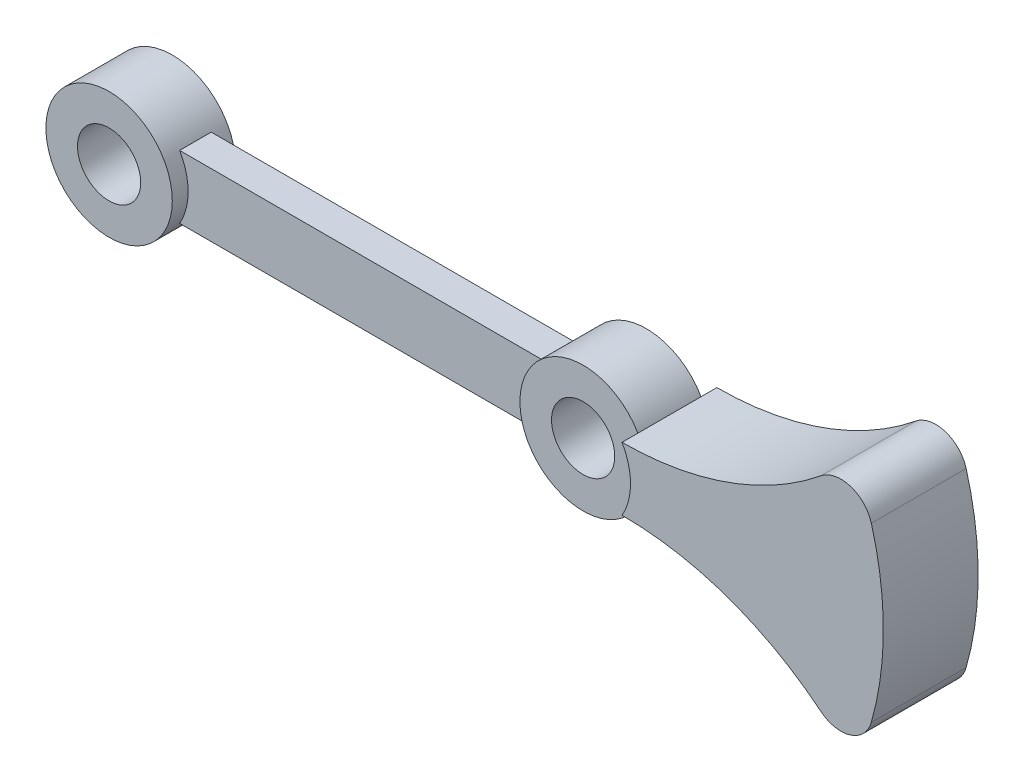
from build123d import *

# Parameters (mm, degrees)
SKETCH1_R             = 12
SKETCH1_R_2           = 6
BOSS_EXTRUDE1_DEPTH   = 6
BOSS_EXTRUDE1_2_DEPTH = 6
BOSS_EXTRUDE2_DEPTH   = 3
BOSS_EXTRUDE3_DEPTH   = 9


with BuildPart() as part:
    # Sketch1 → Boss-Extrude1 (new, symmetric)
    with BuildSketch(Plane.XY):
        with Locations((-45, 0)):
            Circle(SKETCH1_R)
        with Locations((-45, 0)):
            Circle(SKETCH1_R_2, mode=Mode.SUBTRACT)
    extrude(amount=BOSS_EXTRUDE1_DEPTH, both=True)



with BuildPart() as body_2:
    # Sketch1 → Boss-Extrude1 2 (new, symmetric)
    with BuildSketch(Plane.XY):
        with Locations((45, 0)):
            Circle(SKETCH1_R)
        with Locations((45, 0)):
            Circle(SKETCH1_R_2, mode=Mode.SUBTRACT)
    extrude(amount=BOSS_EXTRUDE1_2_DEPTH, both=True)


with BuildPart() as part_1:
    add(part.part)

    add(body_2.part)  # Boss-Extrude2 merges body 2
    # Sketch3 → Boss-Extrude2 (add, symmetric)
    with BuildSketch(Plane.XY):
        with BuildLine():
            Line((-34.607695155, 6), (34.607695155, 6))
            ThreePointArc((34.607695155, 6), (33, 0), (34.607695155, -6))
            Line((34.607695155, -6), (-34.607695155, -6))
            ThreePointArc((-34.607695155, -6), (-33, 0), (-34.607695155, 6))
        make_face()
    extrude(amount=BOSS_EXTRUDE2_DEPTH, both=True)

    # Sketch4 → Boss-Extrude3 (add, symmetric)
    with BuildSketch(Plane.XY):
        with BuildLine():
            ThreePointArc((55.392304845, 6), (75.434547778, 9.446410386), (93.174330904, 19.389716726))
            ThreePointArc((93.174330904, 19.389716726), (98.763947455, 20.448721573), (102.725037233, 16.365209331))
            ThreePointArc((102.725037233, 16.365209331), (105, 0), (102.725037233, -16.365209331))
            ThreePointArc((102.725037233, -16.365209331), (98.763947455, -20.448721573), (93.174330904, -19.389716726))
            ThreePointArc((93.174330904, -19.389716726), (75.434547778, -9.446410386), (55.392304845, -6))
            ThreePointArc((55.392304845, -6), (57, 0), (55.392304845, 6))
        make_face()
    extrude(amount=BOSS_EXTRUDE3_DEPTH, both=True)


solid = part_1.part
